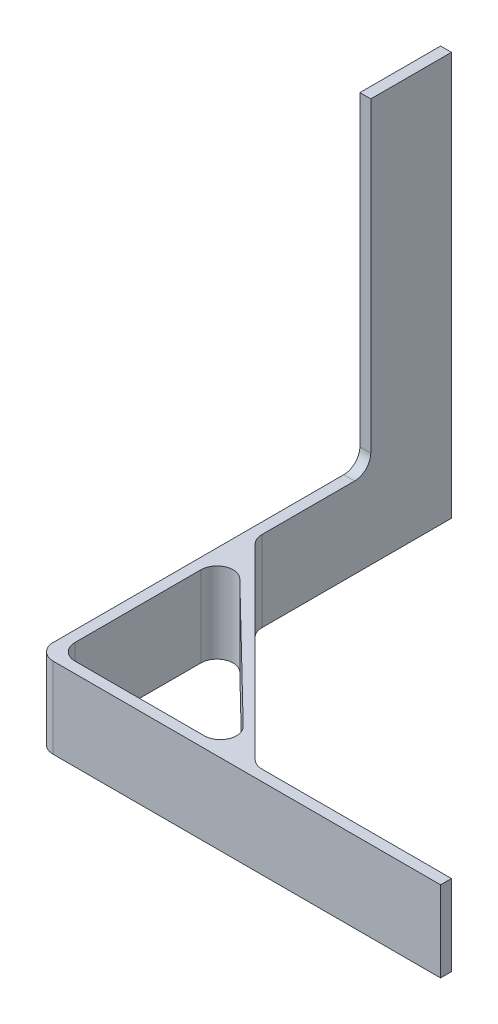
from build123d import *

# Parameters (mm, degrees)
SKETCH1_W           = 250
SKETCH1_H           = 6.75396212
BOSS_EXTRUDE2_DEPTH = 50
SKETCH2_W           = 6.75
SKETCH2_H           = 250
BOSS_EXTRUDE3_DEPTH = 50
BOSS_EXTRUDE4_DEPTH = 50
FILLET1_R           = 10
FILLET2_R           = 10
FILLET3_R           = 10
FILLET4_R           = 10
FILLET5_R           = 10
FILLET6_R           = 10
SKETCH5_W           = 6.75
SKETCH5_H           = 50
BOSS_EXTRUDE5_DEPTH = 250
FILLET7_R           = 10


with BuildPart() as part:
    # Sketch1 → Boss-Extrude2 (new body)
    with BuildSketch(Plane(origin=(0, 0, 0), x_dir=(1, 0, 0), z_dir=(0, 1, 0))):
        with Locations((-125, 3.37698106)):
            Rectangle(SKETCH1_W, SKETCH1_H)
    extrude(amount=BOSS_EXTRUDE2_DEPTH)

    # Sketch2 → Boss-Extrude3 (add)
    with BuildSketch(Plane(origin=(0, 0, 0), x_dir=(1, 0, 0), z_dir=(0, 1, 0))):
        with Locations((-246.625, 125)):
            Rectangle(SKETCH2_W, SKETCH2_H)
    extrude(amount=BOSS_EXTRUDE3_DEPTH)

    # Sketch3 → Boss-Extrude4 (add)
    with BuildSketch(Plane(origin=(0, 0, 0), x_dir=(1, 0, 0), z_dir=(0, 1, 0))):
        Polygon((-243.25, 128.37698106), (-121.625, 6.75396212), (-121.625, 0), (-250, 125), align=None)
    extrude(amount=BOSS_EXTRUDE4_DEPTH)

    # Fillet1
    fillet1_edges = [part.edges().sort_by_distance(p)[0] for p in [
        (-250, 25, 0),
    ]]
    fillet(fillet1_edges, radius=FILLET1_R)

    # Fillet2
    fillet2_edges = [part.edges().sort_by_distance(p)[0] for p in [
        (-243.25, 25, -6.75396212),
    ]]
    fillet(fillet2_edges, radius=FILLET2_R)

    # Fillet3
    fillet3_edges = [part.edges().sort_by_distance(p)[0] for p in [
        (-243.25, 25, -118.427458617),
    ]]
    fillet(fillet3_edges, radius=FILLET3_R)

    # Fillet4
    fillet4_edges = [part.edges().sort_by_distance(p)[0] for p in [
        (-128.561319097, 25, -6.75396212),
    ]]
    fillet(fillet4_edges, radius=FILLET4_R)

    # Fillet5
    fillet5_edges = [part.edges().sort_by_distance(p)[0] for p in [
        (-121.625, 25, -6.75396212),
    ]]
    fillet(fillet5_edges, radius=FILLET5_R)

    # Fillet6
    fillet6_edges = [part.edges().sort_by_distance(p)[0] for p in [
        (-243.25, 25, -128.37698106),
    ]]
    fillet(fillet6_edges, radius=FILLET6_R)

    # Sketch5 → Boss-Extrude5 (add)
    with BuildSketch(Plane(origin=(0, 0, 0), x_dir=(1, 0, 0), z_dir=(0, 1, 0))):
        with Locations((-246.625, 225)):
            Rectangle(SKETCH5_W, SKETCH5_H)
    extrude(amount=BOSS_EXTRUDE5_DEPTH)

    # Fillet7
    fillet7_edges = [part.edges().sort_by_distance(p)[0] for p in [
        (-246.625, 50, -200),
    ]]
    fillet(fillet7_edges, radius=FILLET7_R)


solid = part.part
